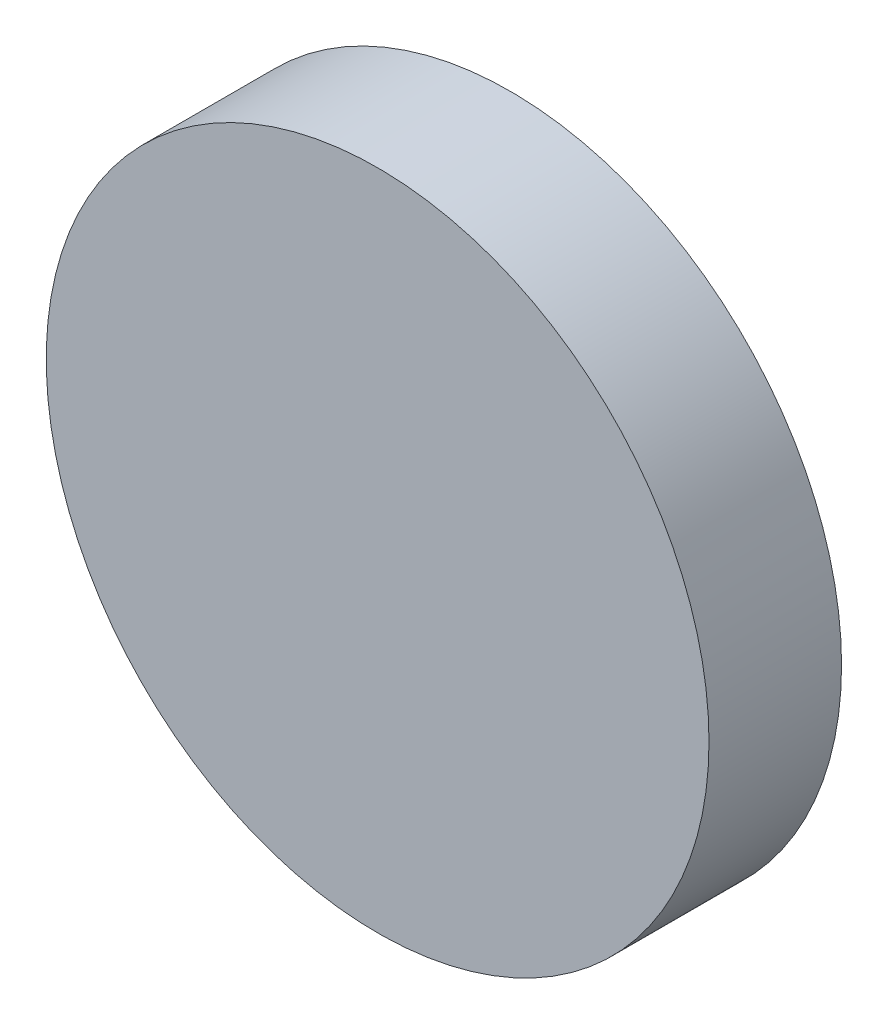
from build123d import *

# Parameters (mm, degrees)
SKETCH1_R           = 15
BOSS_EXTRUDE1_DEPTH = 6


with BuildPart() as part:
    # Sketch1 → Boss-Extrude1 (new body)
    with BuildSketch(Plane(origin=(0, 0, 0), x_dir=(0, 1, 0), z_dir=(0, 0, 1))):
        with Locations(Location((0, 0, 0), (0, 0, 270))):
            Circle(SKETCH1_R)
    extrude(amount=BOSS_EXTRUDE1_DEPTH)


solid = part.part
